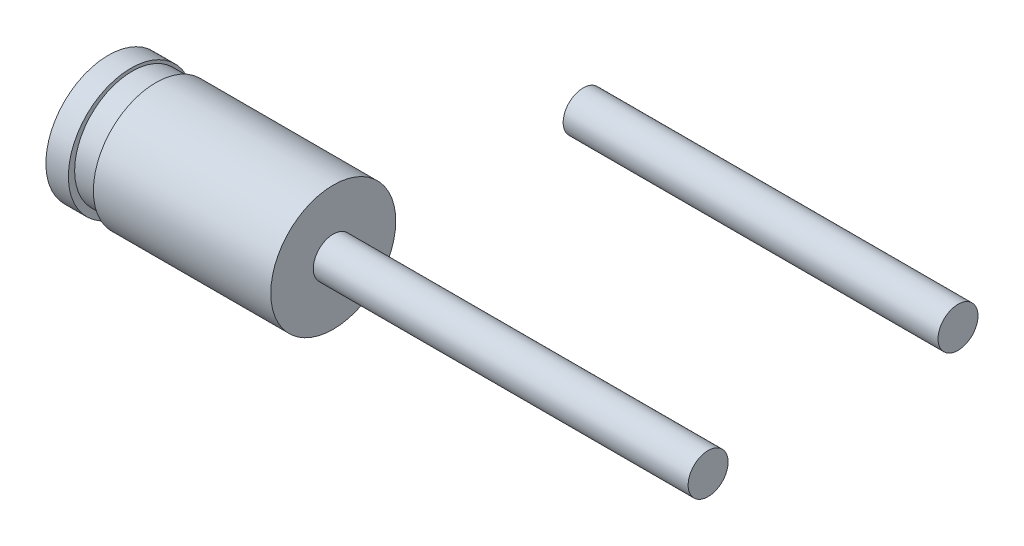
from build123d import *

# Parameters (mm, degrees)
SKETCH_3_R      = 1.25
EXTRUDE_1_DEPTH = 4.5
SKETCH_4_W      = 0.5
SKETCH_4_H      = 0.5
SKETCH_7_R      = 0.4
EXTRUDE_3_DEPTH = 7.5
SKETCH_10_R     = 0.4
EXTRUDE_4_DEPTH = 7.5


with BuildPart() as part:
    # Эскиз3 → Вытянуть1 (new body)
    with BuildSketch(Plane(origin=(2.95, 0, 0), x_dir=(0, 0, -1), z_dir=(1, 0, 0))):
        with Locations((-1.525, -0.033649265)):
            Circle(SKETCH_3_R)
    extrude(amount=EXTRUDE_1_DEPTH)

    # Эскиз4 → Вырез-Повернуть1 (revolve, cut)
    with BuildSketch(Plane(origin=(0, 0, 0), x_dir=(1, 0, 0), z_dir=(0, 1, 0)), mode=Mode.PRIVATE) as cut_revolve_1_sk:
        with Locations((3.65, -0.1)):
            Rectangle(SKETCH_4_W, SKETCH_4_H)
    revolve(cut_revolve_1_sk.sketch.rotate(Axis((0, 0, 1.5), (1, 0, 0)), 180), axis=Axis((0, 0, 1.5), (1, 0, 0)), mode=Mode.SUBTRACT)

    # Эскиз7 → Вытянуть3 (add)
    with BuildSketch(Plane(origin=(7.45, 0, 0), x_dir=(0, 0, -1), z_dir=(1, 0, 0))):
        with Locations((-1.525, -0.033649265)):
            Circle(SKETCH_7_R)
    extrude(amount=EXTRUDE_3_DEPTH)


with BuildPart() as body_2:
    # Эскиз10 → Вытянуть4 (new body)
    with BuildSketch(Plane(origin=(14.95, 0, 0), x_dir=(0, 0, -1), z_dir=(1, 0, 0))):
        with Locations((3.475, 0)):
            Circle(SKETCH_10_R)
    extrude(amount=-EXTRUDE_4_DEPTH)


solid = Compound([part.part, body_2.part])
